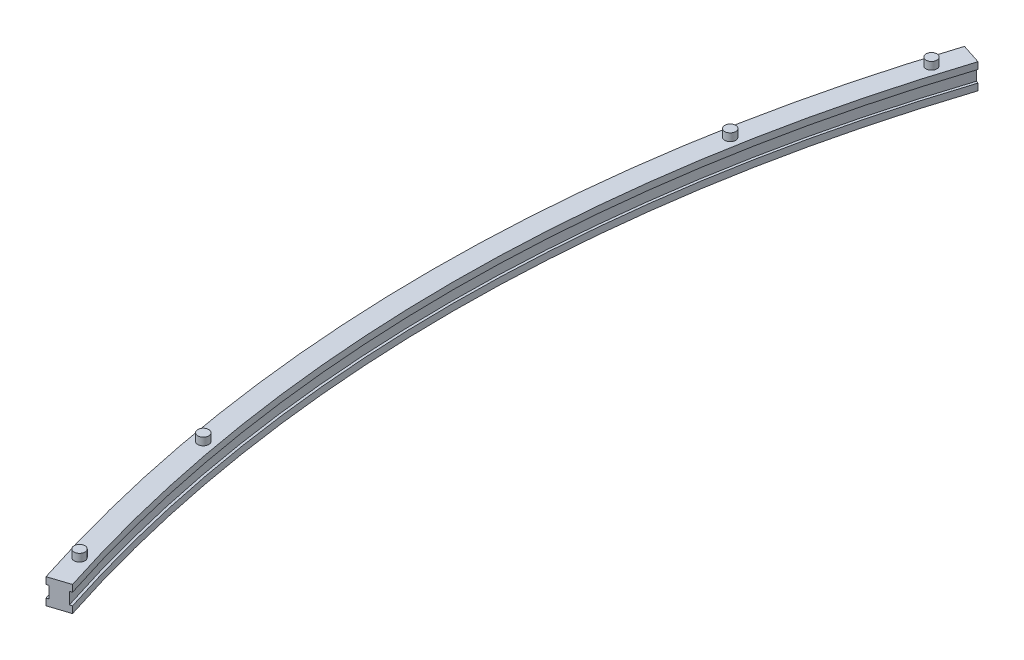
from build123d import *

# Parameters (mm, degrees)
BOSS_EXTRUDE1_DEPTH = 0.8
BOSS_EXTRUDE2_DEPTH = 1.4
BOSS_EXTRUDE3_DEPTH = 0.8
SKETCH1_3_R         = 0.65
BOSS_EXTRUDE4_DEPTH = 3.9


with BuildPart() as part:
    # Sketch1 → Boss-Extrude1 (new body)
    with BuildSketch(Plane(origin=(0, 0, 0), x_dir=(1, 0, 0), z_dir=(0, 1, 0))):
        with BuildLine():
            Line((-167.962153719, -54.574211965), (-165.584512428, -53.801669479))
            ThreePointArc((-165.584512428, -53.801669479), (-174.105859737, 0), (-165.584512428, 53.801669479))
            Line((-165.584512428, 53.801669479), (-167.962153719, 54.574211965))
            ThreePointArc((-167.962153719, 54.574211965), (-176.605859737, 0), (-167.962153719, -54.574211965))
        make_face()
    extrude(amount=BOSS_EXTRUDE1_DEPTH)

    # Sketch2 → Boss-Extrude2 (add)
    with BuildSketch(Plane(origin=(0, 0.8, 0), x_dir=(1, 0, 0), z_dir=(0, 1, 0))):
        with BuildLine():
            Line((-165.869829383, 53.894374577), (-167.676836764, 54.481506867))
            ThreePointArc((-167.676836764, 54.481506867), (-176.305859737, 0), (-167.676836764, -54.481506867))
            Line((-167.676836764, -54.481506867), (-165.869829383, -53.894374577))
            ThreePointArc((-165.869829383, -53.894374577), (-174.405859737, 0), (-165.869829383, 53.894374577))
        make_face()
    extrude(amount=BOSS_EXTRUDE2_DEPTH)

    # Sketch3 → Boss-Extrude3 (add)
    with BuildSketch(Plane(origin=(0, 2.2, 0), x_dir=(1, 0, 0), z_dir=(0, 1, 0))):
        with BuildLine():
            Line((-167.962153719, -54.574211965), (-165.584512428, -53.801669479))
            ThreePointArc((-165.584512428, -53.801669479), (-174.105859737, 0), (-165.584512428, 53.801669479))
            Line((-165.584512428, 53.801669479), (-167.962153719, 54.574211965))
            ThreePointArc((-167.962153719, 54.574211965), (-176.605859737, 0), (-167.962153719, -54.574211965))
        make_face()
    extrude(amount=BOSS_EXTRUDE3_DEPTH)

    # Sketch1<3> → Boss-Extrude4 (add)
    with BuildSketch(Plane(origin=(0, 0, 0), x_dir=(1, 0, 0), z_dir=(0, 1, 0))):
        with Locations((-172.538, -31.31)):
            Circle(SKETCH1_3_R)
        with Locations((-172.538, 31.31)):
            Circle(SKETCH1_3_R)
        with Locations((-167.932, 50.621)):
            Circle(SKETCH1_3_R)
        with Locations((-167.932, -50.621)):
            Circle(SKETCH1_3_R)
    extrude(amount=BOSS_EXTRUDE4_DEPTH)


solid = part.part
